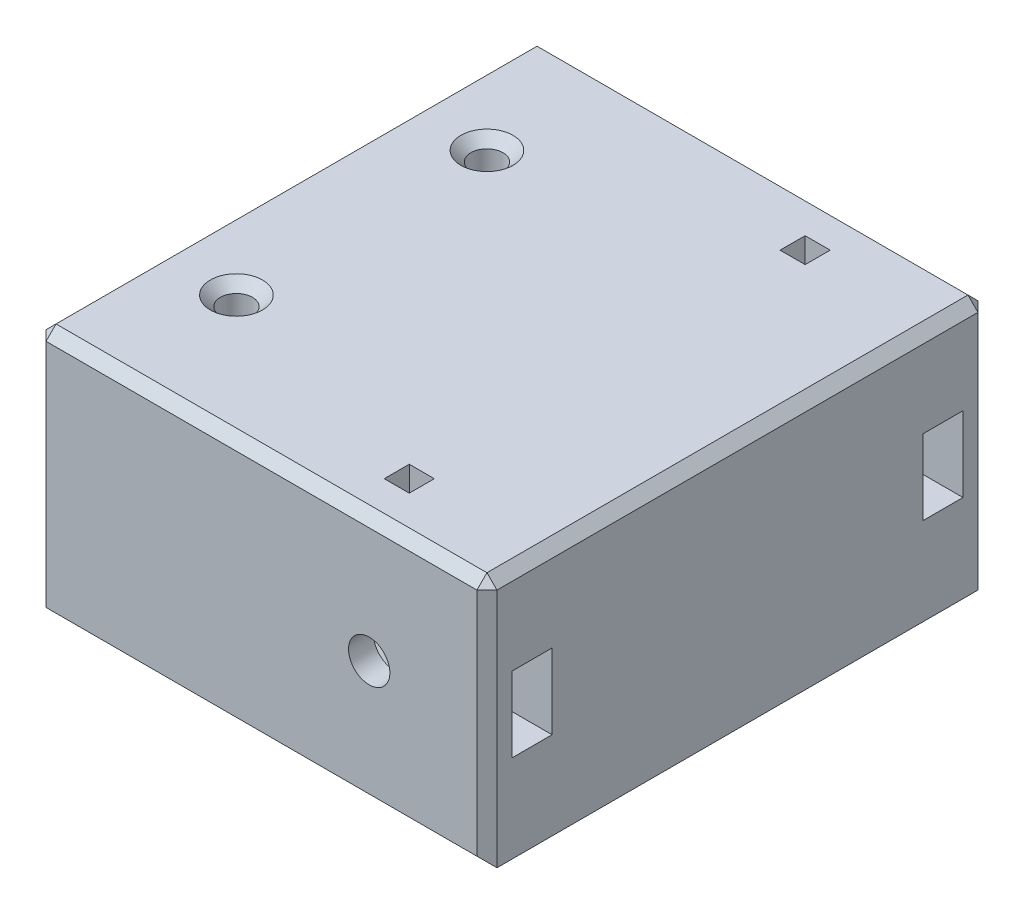
from build123d import *

# Parameters (mm, degrees)
SKETCH1_W               = 50
SKETCH1_H               = 100
BOSS_EXTRUDE1_DEPTH     = 90
CUT_EXTRUDE1_DEPTH      = 115.455231423
CUT_EXTRUDE1_DEPTH_BACK = 115.455231423
SKETCH2_R               = 3.2
CHAMFER1_SIZE           = 2
CUT_EXTRUDE2_START      = -5
SKETCH3_W               = 28.111922991
SKETCH3_H               = 15
CUT_EXTRUDE2_DEPTH      = 8
SKETCH4_R               = 4.125
CUT_EXTRUDE3_DEPTH      = 8
SKETCH6_W               = 5
SKETCH6_H               = 5
CUT_EXTRUDE4_DEPTH      = 108.964114408


with BuildPart() as part:
    # Sketch1 → Boss-Extrude1 (new body)
    with BuildSketch(Plane.YZ):
        Rectangle(SKETCH1_W, SKETCH1_H)
    extrude(amount=BOSS_EXTRUDE1_DEPTH)

    # Sketch2 → Cut-Extrude1 (cut, two sides: drawn at the far end of the back side and taken through both)
    with BuildSketch(Plane(origin=(0, 25, 0), x_dir=(-1, 0, 0), z_dir=(0, 1, 0)).offset(-CUT_EXTRUDE1_DEPTH_BACK)):
        with Locations(Location((-15, -25, 0), (0, 0, 90))):
            Circle(SKETCH2_R)
        with Locations(Location((-15, 25, 0), (0, 0, 270))):
            Circle(SKETCH2_R)
    extrude(amount=CUT_EXTRUDE1_DEPTH + CUT_EXTRUDE1_DEPTH_BACK, mode=Mode.SUBTRACT)

    # Chamfer1
    chamfer1_edges = [part.edges().sort_by_distance(p)[0] for p in [
        (45, 25, 50),
        (45, -25, 50),
        (0, 0, 50),
        (90, 0, 50),
        (45, 25, -50),
        (0, 25, 0),
        (90, 25, 0),
        (15, 25, -28.2),
        (15, 25, 28.2),
        (45, -25, -50),
        (15, -25, 28.2),
        (15, -25, -28.2),
        (0, 0, -50),
        (90, 0, -50),
    ]]
    chamfer(chamfer1_edges, length=CHAMFER1_SIZE)

    # Sketch3 → Cut-Extrude2 (cut)
    with BuildSketch(Plane.XY.offset(50).offset(CUT_EXTRUDE2_START)):
        Polygon((66.5, 7.5), (72.995190528, 3.75), (72.995190528, -3.75), (66.5, -7.5), (88, -7.5), (88, 7.5), align=None)
        with Locations((102.055961496, 0)):
            Rectangle(SKETCH3_W, SKETCH3_H)
        Polygon((66.5, -7.5), (72.995190528, -3.75), (72.995190528, 3.75), (66.5, 7.5), (60.004809472, 3.75), (60.004809472, -3.75), align=None)
    cut_extrude2 = extrude(amount=-CUT_EXTRUDE2_DEPTH, mode=Mode.SUBTRACT)

    # Sketch4 → Cut-Extrude3 (cut)
    with BuildSketch(Plane.XY.offset(50)):
        with Locations((66.5, 0)):
            Circle(SKETCH4_R)
    cut_extrude3 = extrude(amount=-CUT_EXTRUDE3_DEPTH, mode=Mode.SUBTRACT)

    # Sketch6 → Cut-Extrude4 (cut, symmetric)
    with BuildSketch(Plane.XZ.offset(-7.5)):
        with Locations((64, 39.5)):
            Rectangle(SKETCH6_W, SKETCH6_H)
    cut_extrude4 = extrude(amount=CUT_EXTRUDE4_DEPTH, both=True, mode=Mode.SUBTRACT)

    # Mirror1: Cut-Extrude2, Cut-Extrude3, Cut-Extrude4 across plane
    add(cut_extrude2.mirror(Plane.XY), mode=Mode.SUBTRACT)
    add(cut_extrude3.mirror(Plane.XY), mode=Mode.SUBTRACT)
    add(cut_extrude4.mirror(Plane.XY), mode=Mode.SUBTRACT)


solid = part.part
